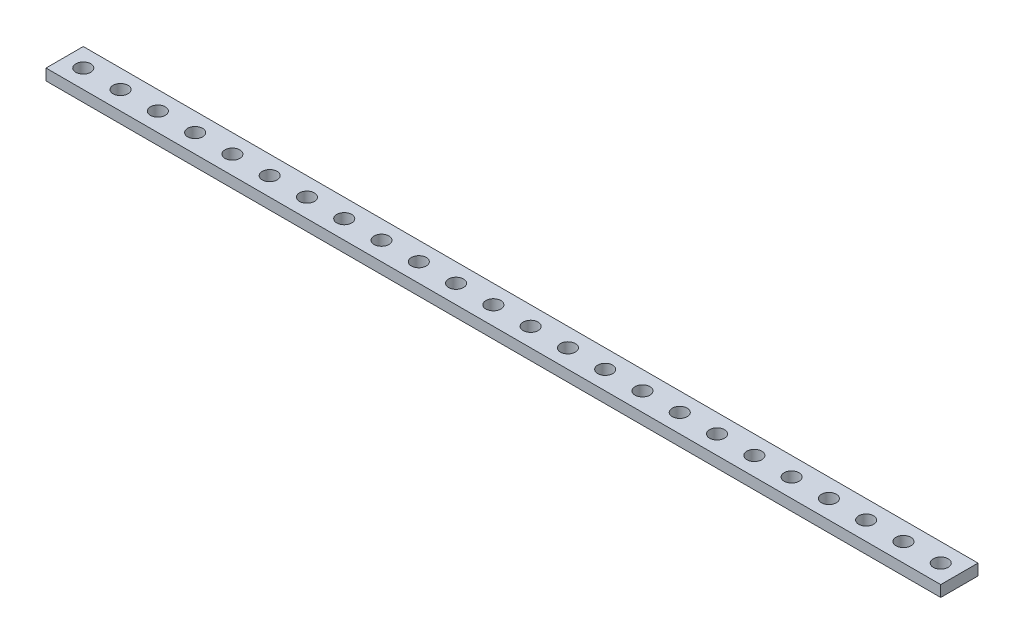
from build123d import *

# Parameters (mm, degrees)
ESQUISSE1_R             = 2
BOSS_EXTRU_1_DEPTH      = 3
ENL_V_MAT_EXTRU_1_REACH = 142.389
ESQUISSE2_W             = 40
ESQUISSE2_H             = 10


with BuildPart() as part:
    # Esquisse1 → Boss.-Extru.1 (new body)
    with BuildSketch(Plane(origin=(0, 0, 0), x_dir=(1, 0, 0), z_dir=(0, 1, 0))):
        Polygon((0, 0), (140, 0), (140, 10), (-140, 10), (-140, 0), align=None)
        with Locations(Location((-135, 5, 0), (0, 0, 270))):
            Circle(ESQUISSE1_R, mode=Mode.SUBTRACT)
        with Locations(Location((-125, 5, 0), (0, 0, 270))):
            Circle(ESQUISSE1_R, mode=Mode.SUBTRACT)
        with Locations(Location((-115, 5, 0), (0, 0, 270))):
            Circle(ESQUISSE1_R, mode=Mode.SUBTRACT)
        with Locations(Location((-105, 5, 0), (0, 0, 270))):
            Circle(ESQUISSE1_R, mode=Mode.SUBTRACT)
        with Locations(Location((-95, 5, 0), (0, 0, 270))):
            Circle(ESQUISSE1_R, mode=Mode.SUBTRACT)
        with Locations(Location((-85, 5, 0), (0, 0, 270))):
            Circle(ESQUISSE1_R, mode=Mode.SUBTRACT)
        with Locations(Location((-75, 5, 0), (0, 0, 270))):
            Circle(ESQUISSE1_R, mode=Mode.SUBTRACT)
        with Locations(Location((-65, 5, 0), (0, 0, 270))):
            Circle(ESQUISSE1_R, mode=Mode.SUBTRACT)
        with Locations(Location((-55, 5, 0), (0, 0, 270))):
            Circle(ESQUISSE1_R, mode=Mode.SUBTRACT)
        with Locations(Location((-45, 5, 0), (0, 0, 270))):
            Circle(ESQUISSE1_R, mode=Mode.SUBTRACT)
        with Locations(Location((-35, 5, 0), (0, 0, 270))):
            Circle(ESQUISSE1_R, mode=Mode.SUBTRACT)
        with Locations(Location((-25, 5, 0), (0, 0, 270))):
            Circle(ESQUISSE1_R, mode=Mode.SUBTRACT)
        with Locations(Location((-15, 5, 0), (0, 0, 270))):
            Circle(ESQUISSE1_R, mode=Mode.SUBTRACT)
        with Locations(Location((-5, 5, 0), (0, 0, 270))):
            Circle(ESQUISSE1_R, mode=Mode.SUBTRACT)
        with Locations(Location((5, 5, 0), (0, 0, 270))):
            Circle(ESQUISSE1_R, mode=Mode.SUBTRACT)
        with Locations(Location((15, 5, 0), (0, 0, 270))):
            Circle(ESQUISSE1_R, mode=Mode.SUBTRACT)
        with Locations(Location((25, 5, 0), (0, 0, 270))):
            Circle(ESQUISSE1_R, mode=Mode.SUBTRACT)
        with Locations(Location((35, 5, 0), (0, 0, 270))):
            Circle(ESQUISSE1_R, mode=Mode.SUBTRACT)
        with Locations(Location((45, 5, 0), (0, 0, 270))):
            Circle(ESQUISSE1_R, mode=Mode.SUBTRACT)
        with Locations(Location((55, 5, 0), (0, 0, 270))):
            Circle(ESQUISSE1_R, mode=Mode.SUBTRACT)
        with Locations(Location((65, 5, 0), (0, 0, 270))):
            Circle(ESQUISSE1_R, mode=Mode.SUBTRACT)
        with Locations(Location((75, 5, 0), (0, 0, 270))):
            Circle(ESQUISSE1_R, mode=Mode.SUBTRACT)
        with Locations(Location((85, 5, 0), (0, 0, 270))):
            Circle(ESQUISSE1_R, mode=Mode.SUBTRACT)
        with Locations(Location((95, 5, 0), (0, 0, 270))):
            Circle(ESQUISSE1_R, mode=Mode.SUBTRACT)
        with Locations(Location((105, 5, 0), (0, 0, 270))):
            Circle(ESQUISSE1_R, mode=Mode.SUBTRACT)
        with Locations(Location((115, 5, 0), (0, 0, 270))):
            Circle(ESQUISSE1_R, mode=Mode.SUBTRACT)
        with Locations(Location((125, 5, 0), (0, 0, 270))):
            Circle(ESQUISSE1_R, mode=Mode.SUBTRACT)
        with Locations(Location((135, 5, 0), (0, 0, 270))):
            Circle(ESQUISSE1_R, mode=Mode.SUBTRACT)
    extrude(amount=BOSS_EXTRU_1_DEPTH)

    # Esquisse2 → Enlèv. mat.-Extru.1 (cut, up to next)
    with BuildSketch(Plane(origin=(0, 3, 0), x_dir=(1, 0, 0), z_dir=(0, 1, 0)), mode=Mode.PRIVATE) as enl_v_mat_extru_1_sk1:
        with Locations((120, 5)):
            Rectangle(ESQUISSE2_W, ESQUISSE2_H)
    enl_v_mat_extru_1_tool1 = extrude(enl_v_mat_extru_1_sk1.sketch, amount=-ENL_V_MAT_EXTRU_1_REACH, mode=Mode.PRIVATE) & part.part
    add(enl_v_mat_extru_1_tool1.solids().sort_by_distance((120, 3, -5))[0], mode=Mode.SUBTRACT)


solid = part.part
